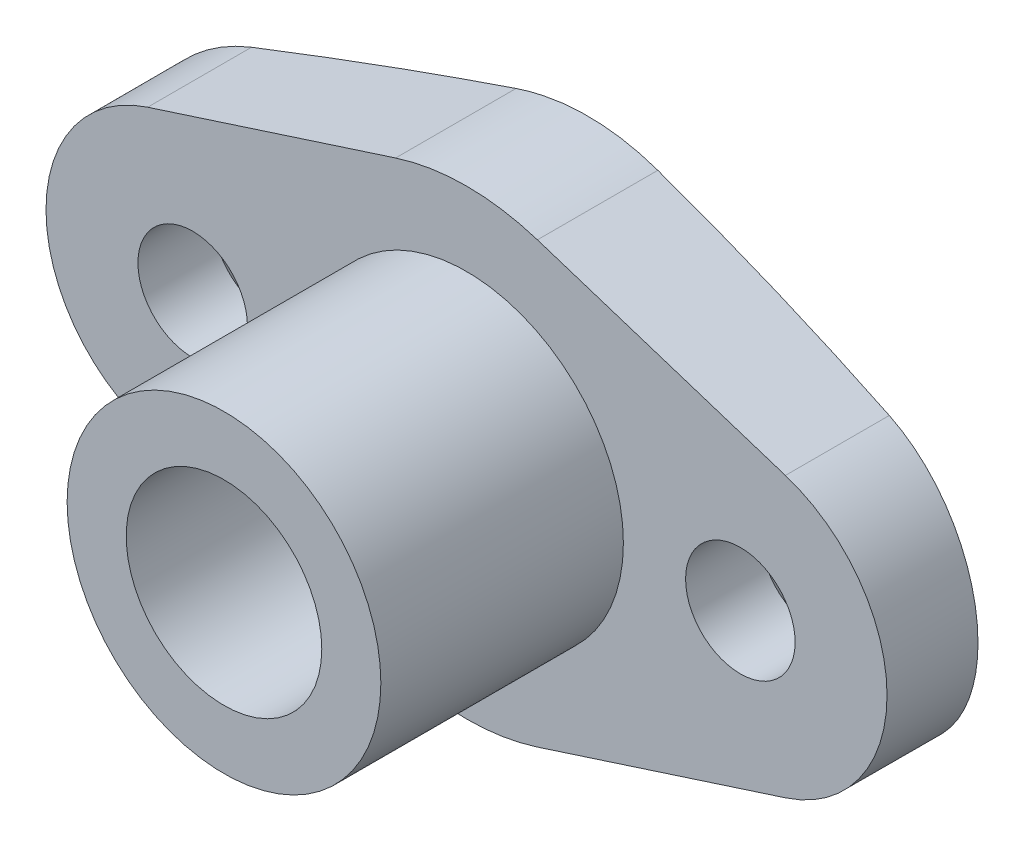
from build123d import *

# Parameters (mm, degrees)
SKETCH3_R          = 1.778
EXTRUDE1_DEPTH     = 3.937
SKETCH4_R          = 5.0927
SKETCH4_R_2        = 3.175
EXTRUDE2_DEPTH     = 7.874
CUT_EXTRUDE2_DEPTH = 38.1


with BuildPart() as part:
    # Sketch3 → Extrude1 (new body)
    with BuildSketch(Plane.XY):
        with BuildLine():
            Line((2.301421429, 7.130814007), (10.352767857, 4.532297039))
            ThreePointArc((10.352767857, 4.532297039), (13.6525, 0), (10.352767857, -4.532297039))
            Line((10.352767857, -4.532297039), (2.301421429, -7.130814007))
            ThreePointArc((2.301421429, -7.130814007), (0, -7.493), (-2.301421429, -7.130814007))
            Line((-2.301421429, -7.130814007), (-10.352767857, -4.532297039))
            ThreePointArc((-10.352767857, -4.532297039), (-13.6525, 0), (-10.352767857, 4.532297039))
            Line((-10.352767857, 4.532297039), (-2.301421429, 7.130814007))
            ThreePointArc((-2.301421429, 7.130814007), (0, 7.493), (2.301421429, 7.130814007))
        make_face()
        with Locations((-8.89, 0)):
            Circle(SKETCH3_R, mode=Mode.SUBTRACT)
        with Locations((8.89, 0)):
            Circle(SKETCH3_R, mode=Mode.SUBTRACT)
    extrude(amount=EXTRUDE1_DEPTH)

    # Sketch4 → Extrude2 (add)
    with BuildSketch(Plane.XY.offset(3.937)):
        Circle(SKETCH4_R)
        Circle(SKETCH4_R_2, mode=Mode.SUBTRACT)
    extrude(amount=EXTRUDE2_DEPTH)

    # Cut-Extrude1 cone 1 section (through the dimple's axis) → Cut-Extrude1 (revolve, cut)
    with BuildSketch(Plane.YZ.offset(8.89)):
        Polygon((0, 0), (3.556, 0), (0, 2.983838288), align=None)
    revolve(axis=Axis((8.89, 0, 0), (0, 0, 1)), mode=Mode.SUBTRACT)

    # Cut-Extrude1 cone 2 section (through the dimple's axis) → Cut-Extrude1 cone 2 (revolve, cut)
    with BuildSketch(Plane.YZ.offset(-8.89)):
        Polygon((0, 0), (3.556, 0), (0, 2.983838288), align=None)
    revolve(axis=Axis((-8.89, 0, 0), (0, 0, 1)), mode=Mode.SUBTRACT)

    # Sketch6 → Cut-Extrude2 (cut, symmetric)
    with BuildSketch(Plane(origin=(0, 0, 0), x_dir=(1, 0, 0), z_dir=(0, 1, 0))):
        with BuildLine():
            Line((13.6525, -0.98425), (13.6525, 0.508))
            Line((13.6525, 0.508), (-13.6525, 0.508))
            Line((-13.6525, 0.508), (-13.6525, -0.98425))
            ThreePointArc((-13.6525, -0.98425), (0, 0), (13.6525, -0.98425))
        make_face()
    extrude(amount=CUT_EXTRUDE2_DEPTH, both=True, mode=Mode.SUBTRACT)


solid = part.part
